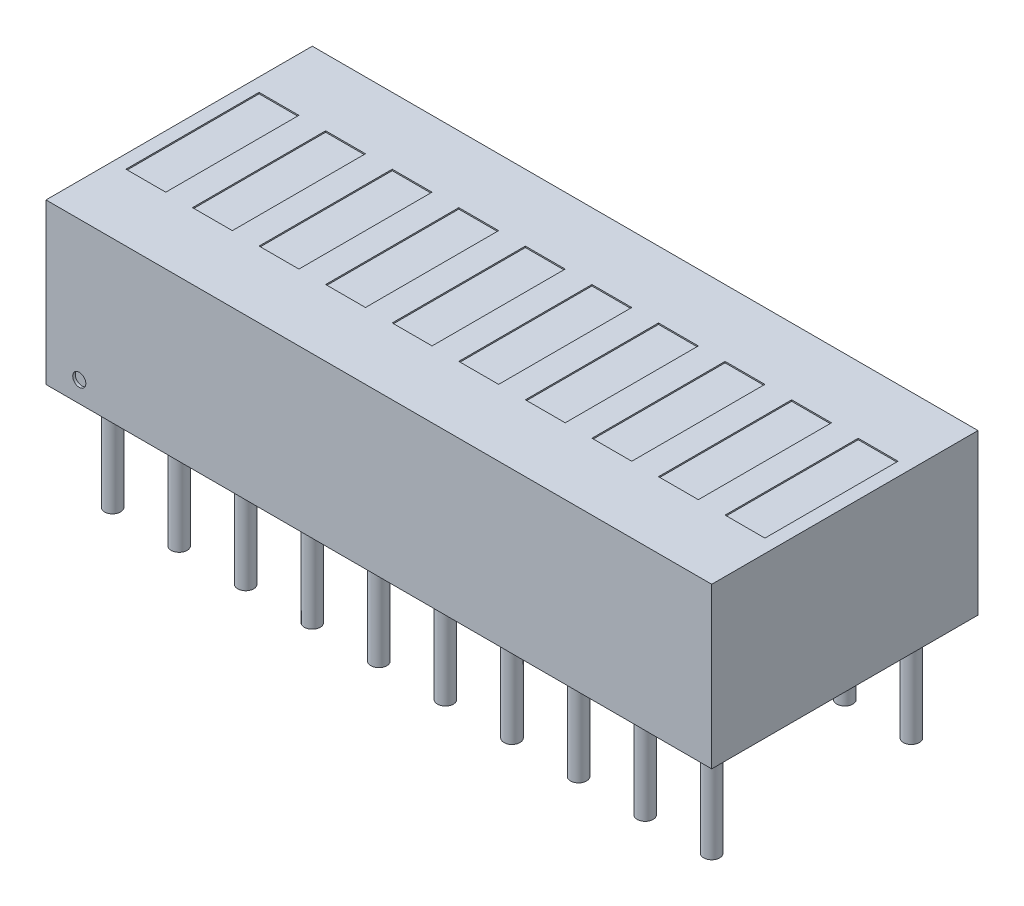
from build123d import *

# Parameters (mm, degrees)
SKETCH1_W           = 25.4
SKETCH1_H           = 10.16
BOSS_EXTRUDE1_DEPTH = 6.1
SKETCH2_W           = 1.52
SKETCH2_H           = 5.08
CUT_EXTRUDE1_DEPTH  = 0.05
SKETCH3_R           = 0.305
BOSS_EXTRUDE2_DEPTH = 4.06
SKETCH4_R           = 0.25
CUT_EXTRUDE2_DEPTH  = 0.1


with BuildPart() as part:
    # Sketch1 → Boss-Extrude1 (new body)
    with BuildSketch(Plane(origin=(0, 0, 0), x_dir=(1, 0, 0), z_dir=(0, 1, 0))):
        Rectangle(SKETCH1_W, SKETCH1_H)
    extrude(amount=BOSS_EXTRUDE1_DEPTH)

    # Sketch2 → Cut-Extrude1 (cut)
    with BuildSketch(Plane(origin=(0, 6.1, 0), x_dir=(1, 0, 0), z_dir=(0, 1, 0))):
        with Locations((-3.81, 0)):
            Rectangle(SKETCH2_W, SKETCH2_H)
        with Locations((-1.27, 0)):
            Rectangle(SKETCH2_W, SKETCH2_H)
        with Locations((-6.35, 0)):
            Rectangle(SKETCH2_W, SKETCH2_H)
        with Locations((-8.89, 0)):
            Rectangle(SKETCH2_W, SKETCH2_H)
        with Locations((-11.43, 0)):
            Rectangle(SKETCH2_W, SKETCH2_H)
        with Locations((11.43, 0)):
            Rectangle(SKETCH2_W, SKETCH2_H)
        with Locations((8.89, 0)):
            Rectangle(SKETCH2_W, SKETCH2_H)
        with Locations((6.35, 0)):
            Rectangle(SKETCH2_W, SKETCH2_H)
        with Locations((3.81, 0)):
            Rectangle(SKETCH2_W, SKETCH2_H)
        with Locations((1.27, 0)):
            Rectangle(SKETCH2_W, SKETCH2_H)
    extrude(amount=-CUT_EXTRUDE1_DEPTH, mode=Mode.SUBTRACT)

    # Sketch3 → Boss-Extrude2 (add)
    with BuildSketch(Plane.XZ):
        with Locations(Location((-1.27, 3.81, 0), (0, 0, 270))):
            Circle(SKETCH3_R)
        with Locations(Location((-3.81, 3.81, 0), (0, 0, 270))):
            Circle(SKETCH3_R)
        with Locations(Location((-6.35, 3.81, 0), (0, 0, 270))):
            Circle(SKETCH3_R)
        with Locations(Location((-8.89, 3.81, 0), (0, 0, 270))):
            Circle(SKETCH3_R)
        with Locations(Location((-11.43, 3.81, 0), (0, 0, 270))):
            Circle(SKETCH3_R)
        with Locations(Location((-3.81, -3.81, 0), (0, 0, 270))):
            Circle(SKETCH3_R)
        with Locations(Location((-6.35, -3.81, 0), (0, 0, 270))):
            Circle(SKETCH3_R)
        with Locations(Location((-8.89, -3.81, 0), (0, 0, 270))):
            Circle(SKETCH3_R)
        with Locations(Location((-11.43, -3.81, 0), (0, 0, 270))):
            Circle(SKETCH3_R)
        with Locations(Location((-1.27, -3.81, 0), (0, 0, 270))):
            Circle(SKETCH3_R)
        with Locations(Location((11.43, -3.81, 0), (0, 0, 90))):
            Circle(SKETCH3_R)
        with Locations(Location((8.89, -3.81, 0), (0, 0, 90))):
            Circle(SKETCH3_R)
        with Locations(Location((6.35, -3.81, 0), (0, 0, 90))):
            Circle(SKETCH3_R)
        with Locations(Location((3.81, -3.81, 0), (0, 0, 90))):
            Circle(SKETCH3_R)
        with Locations(Location((1.27, -3.81, 0), (0, 0, 90))):
            Circle(SKETCH3_R)
        with Locations(Location((1.27, 3.81, 0), (0, 0, 90))):
            Circle(SKETCH3_R)
        with Locations(Location((3.81, 3.81, 0), (0, 0, 90))):
            Circle(SKETCH3_R)
        with Locations(Location((6.35, 3.81, 0), (0, 0, 90))):
            Circle(SKETCH3_R)
        with Locations(Location((8.89, 3.81, 0), (0, 0, 90))):
            Circle(SKETCH3_R)
        with Locations(Location((11.43, 3.81, 0), (0, 0, 90))):
            Circle(SKETCH3_R)
    extrude(amount=BOSS_EXTRUDE2_DEPTH)

    # Sketch4 → Cut-Extrude2 (cut)
    with BuildSketch(Plane.XY.offset(5.08)):
        with Locations((-11.43, 0.790183666)):
            Circle(SKETCH4_R)
    extrude(amount=-CUT_EXTRUDE2_DEPTH, mode=Mode.SUBTRACT)


solid = part.part
